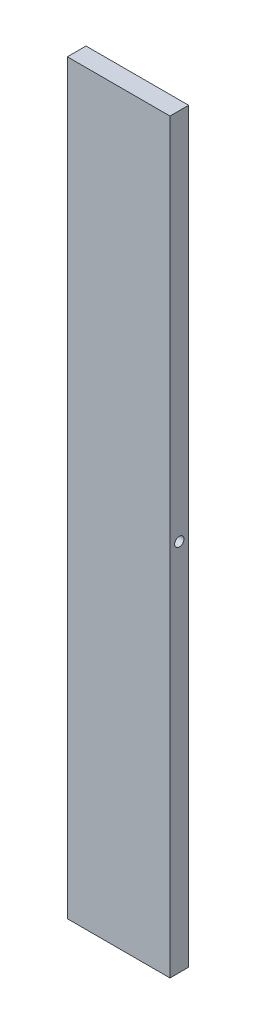
from build123d import *

# Parameters (mm, degrees)
SKETCH1_W           = 20
SKETCH1_H           = 800
SKETCH1_R           = 5
BOSS_EXTRUDE1_DEPTH = 55


with BuildPart() as part:
    # Sketch1 → Boss-Extrude1 (new, symmetric)
    with BuildSketch(Plane(origin=(0, 0, 0), x_dir=(0, 0, -1), z_dir=(1, 0, 0))):
        Rectangle(SKETCH1_W, SKETCH1_H)
        Circle(SKETCH1_R, mode=Mode.SUBTRACT)
    extrude(amount=BOSS_EXTRUDE1_DEPTH, both=True)


solid = part.part
